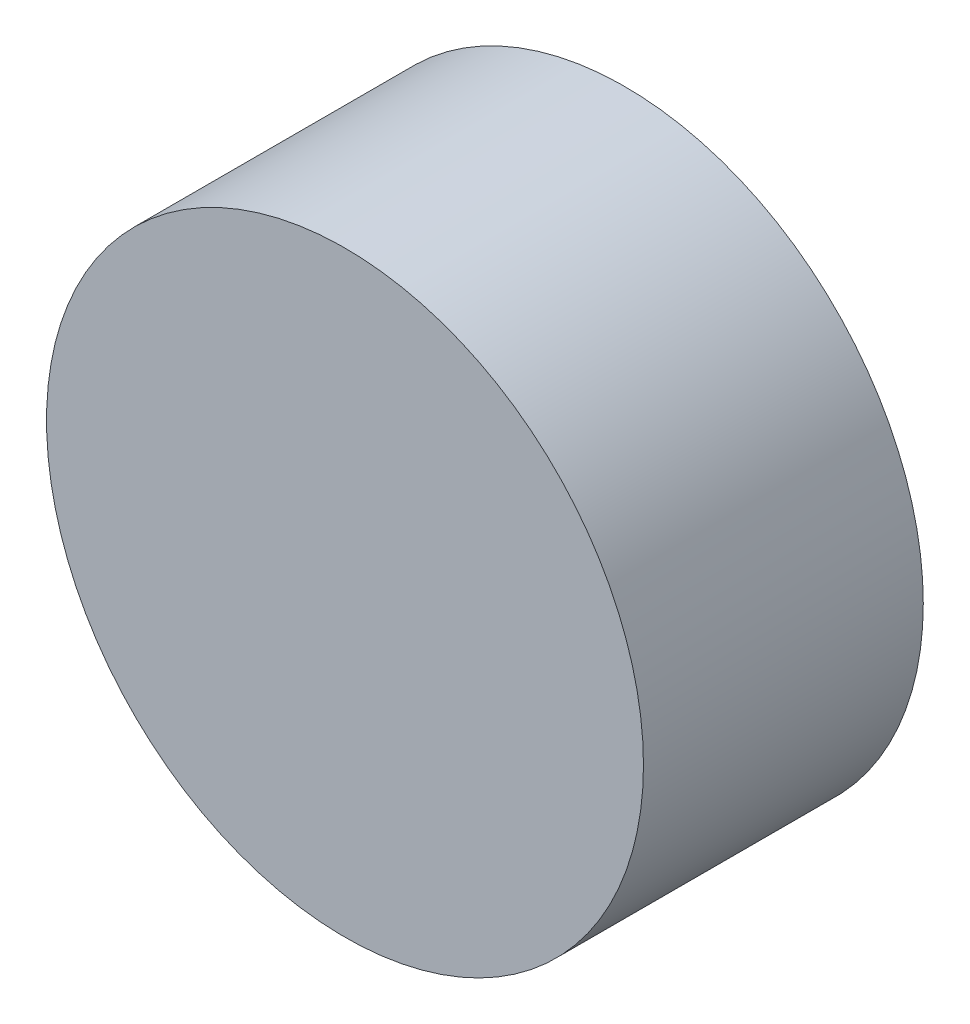
from build123d import *

# Parameters (mm, degrees)
SKETCH2_R           = 32
BOSS_EXTRUDE1_DEPTH = 30


with BuildPart() as part:
    # Sketch2 → Boss-Extrude1 (new body)
    with BuildSketch(Plane.XY):
        Circle(SKETCH2_R)
    extrude(amount=BOSS_EXTRUDE1_DEPTH)


solid = part.part
